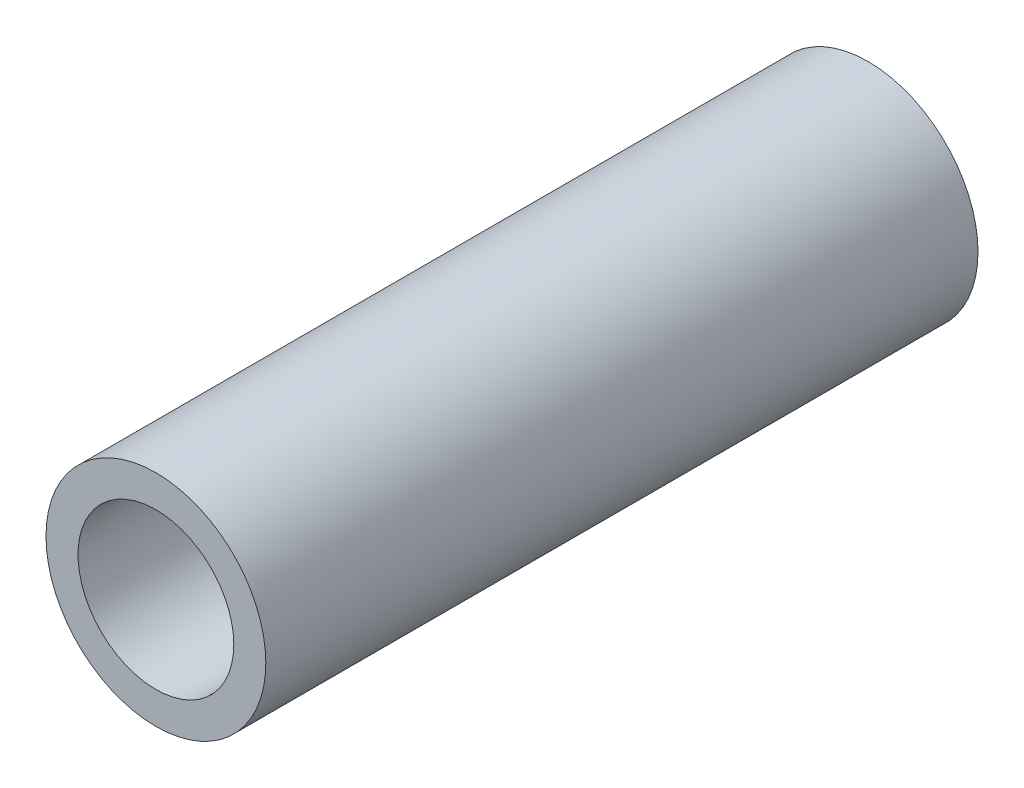
from build123d import *

# Parameters (mm, degrees)
SKETCH1_R           = 3.175
SKETCH1_R_2         = 2.2499955
BOSS_EXTRUDE1_DEPTH = 20.574


with BuildPart() as part:
    # Sketch1 → Boss-Extrude1 (new body)
    with BuildSketch(Plane.XY):
        Circle(SKETCH1_R)
        Circle(SKETCH1_R_2, mode=Mode.SUBTRACT)
    extrude(amount=BOSS_EXTRUDE1_DEPTH)


solid = part.part
